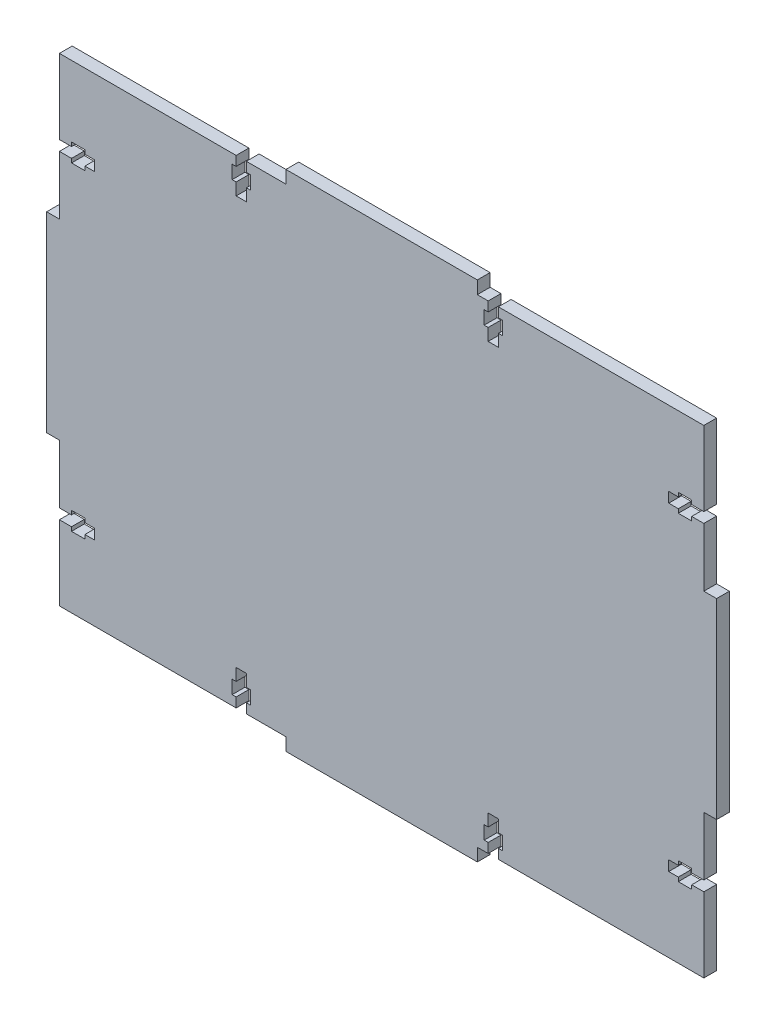
from build123d import *

# Parameters (mm, degrees)
ESQUISSE1_W             = 202
ESQUISSE1_H             = 150
BOSS_EXTRU_1_DEPTH      = 4
ESQUISSE2_W             = 4
ESQUISSE2_H             = 60
ESQUISSE2_W_2           = 60
ESQUISSE2_H_2           = 4
BOSS_EXTRU_2_DEPTH      = 4
ENL_V_MAT_EXTRU_1_DEPTH = 10
ENL_V_MAT_EXTRU_2_DEPTH = 4


with BuildPart() as part:
    # Esquisse1 → Boss.-Extru.1 (new body)
    with BuildSketch(Plane.XY):
        Rectangle(ESQUISSE1_W, ESQUISSE1_H)
    extrude(amount=BOSS_EXTRU_1_DEPTH)

    # Esquisse2 → Boss.-Extru.2 (add)
    with BuildSketch(Plane(origin=(0, 0, 0), x_dir=(-1, 0, 0), z_dir=(0, 0, -1))):
        with Locations((-103, 0)):
            Rectangle(ESQUISSE2_W, ESQUISSE2_H)
        with Locations((103, 0)):
            Rectangle(ESQUISSE2_W, ESQUISSE2_H)
        with Locations((0, -77)):
            Rectangle(ESQUISSE2_W_2, ESQUISSE2_H_2)
        with Locations((0, 77)):
            Rectangle(ESQUISSE2_W_2, ESQUISSE2_H_2)
    extrude(amount=-BOSS_EXTRU_2_DEPTH)

    # Esquisse3 → Enlèv. mat.-Extru.1 (cut)
    with BuildSketch(Plane(origin=(0, 0, 0), x_dir=(-1, 0, 0), z_dir=(0, 0, -1))):
        Polygon((42.4, 75), (45.6, 75), (45.6, 72), (46.85, 72), (46.85, 67.8), (45.6, 67.8), (45.6, 64), (42.4, 64), (42.4, 67.8), (41.15, 67.8), (41.15, 72), (42.4, 72), align=None)
        Polygon((-36.6, 75), (-33.4, 75), (-33.4, 72), (-32.15, 72), (-32.15, 67.8), (-33.4, 67.8), (-33.4, 64), (-36.6, 64), (-36.6, 67.8), (-37.85, 67.8), (-37.85, 72), (-36.6, 72), align=None)
        Polygon((-33.4, -75), (-33.4, -72), (-32.15, -72), (-32.15, -67.8), (-33.4, -67.8), (-33.4, -64), (-36.6, -64), (-36.6, -67.8), (-37.85, -67.8), (-37.85, -72), (-36.6, -72), (-36.6, -75), align=None)
        Polygon((45.6, -75), (45.6, -72), (46.85, -72), (46.85, -67.8), (45.6, -67.8), (45.6, -64), (42.4, -64), (42.4, -67.8), (41.15, -67.8), (41.15, -72), (42.4, -72), (42.4, -75), align=None)
    extrude(amount=-ENL_V_MAT_EXTRU_1_DEPTH, mode=Mode.SUBTRACT)

    # Esquisse4 → Enlèv. mat.-Extru.2 (cut)
    with BuildSketch(Plane.XY.offset(4)):
        Polygon((90, 48.4), (93, 48.4), (93, 47.15), (97.2, 47.15), (97.2, 48.4), (101, 48.4), (101, 51.6), (97.2, 51.6), (97.2, 52.85), (93, 52.85), (93, 51.6), (90, 51.6), align=None)
        Polygon((97.2, -51.6), (101, -51.6), (101, -48.4), (97.2, -48.4), (97.2, -47.15), (93, -47.15), (93, -48.4), (90, -48.4), (90, -51.6), (93, -51.6), (93, -52.85), (97.2, -52.85), align=None)
        Polygon((-90, -48.4), (-93, -48.4), (-93, -47.15), (-97.2, -47.15), (-97.2, -48.4), (-101, -48.4), (-101, -51.6), (-97.2, -51.6), (-97.2, -52.85), (-93, -52.85), (-93, -51.6), (-90, -51.6), align=None)
        Polygon((-97.2, 51.6), (-101, 51.6), (-101, 48.4), (-97.2, 48.4), (-97.2, 47.15), (-93, 47.15), (-93, 48.4), (-90, 48.4), (-90, 51.6), (-93, 51.6), (-93, 52.85), (-97.2, 52.85), align=None)
    extrude(amount=-ENL_V_MAT_EXTRU_2_DEPTH, mode=Mode.SUBTRACT)


solid = part.part
